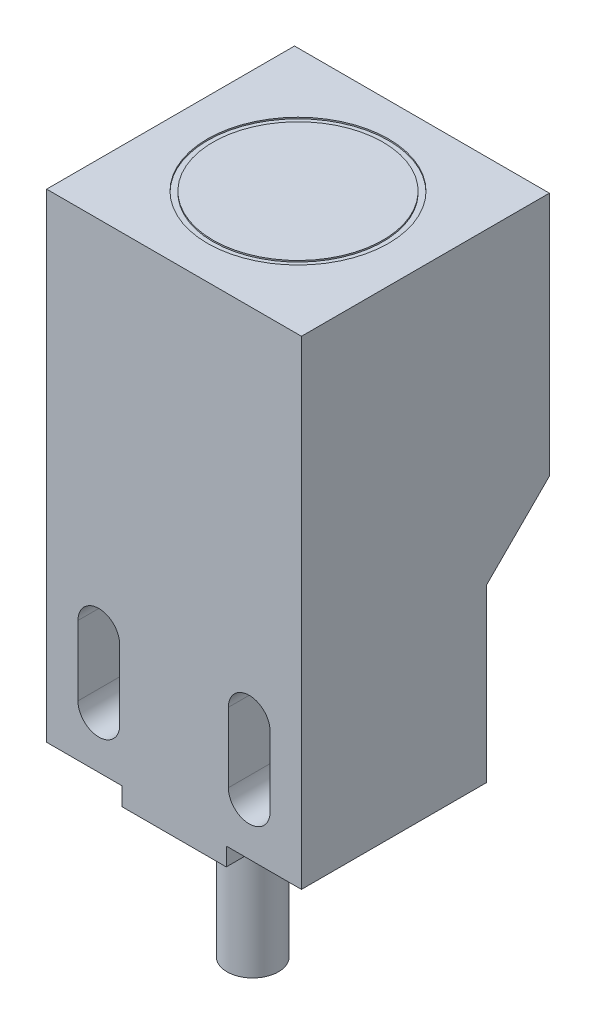
from build123d import *

# Parameters (mm, degrees)
ESQUISSE1_W                  = 18.3
ESQUISSE1_H                  = 17.8
BOSS_EXTRU_1_DEPTH           = 34.4
ENL_V_MAT_EXTRU_1_DEPTH      = 37.69185877
ENL_V_MAT_EXTRU_1_DEPTH_BACK = 37.69185877
ENL_V_MAT_EXTRU_2_DEPTH      = 37.69185877
ENL_V_MAT_EXTRU_2_DEPTH_BACK = 37.69185877
ESQUISSE4_R                  = 4.25
BOSS_EXTRU_2_DEPTH           = 2.2
ESQUISSE5_R                  = 2.45
BOSS_EXTRU_3_DEPTH           = 2.1
BOSS_EXTRU_4_DEPTH           = 1.3
ESQUISSE7_R                  = 1.85
BOSS_EXTRU_5_DEPTH           = 10.3
ESQUISSE8_R                  = 6.5
ESQUISSE8_R_2                = 6.1
ENL_V_MAT_EXTRU_3_DEPTH      = 0.1


with BuildPart() as part:
    # Esquisse1 → Boss.-Extru.1 (new body)
    with BuildSketch(Plane(origin=(0, 0, 0), x_dir=(1, 0, 0), z_dir=(0, 1, 0))):
        Rectangle(ESQUISSE1_W, ESQUISSE1_H)
    extrude(amount=-BOSS_EXTRU_1_DEPTH)

    # Esquisse2 → Enlèv. mat.-Extru.1 (cut, two sides: drawn at the far end of the back side and taken through both)
    with BuildSketch(Plane(origin=(0, 0, 0), x_dir=(0, 0, -1), z_dir=(1, 0, 0)).offset(-ENL_V_MAT_EXTRU_1_DEPTH_BACK)):
        Polygon((8.9, -17.6), (4.4, -22.1), (4.4, -34.4), (8.9, -34.4), align=None)
    extrude(amount=ENL_V_MAT_EXTRU_1_DEPTH + ENL_V_MAT_EXTRU_1_DEPTH_BACK, mode=Mode.SUBTRACT)

    # Esquisse3 → Enlèv. mat.-Extru.2 (cut, two sides: drawn at the far end of the back side and taken through both)
    with BuildSketch(Plane.XY.offset(-ENL_V_MAT_EXTRU_2_DEPTH_BACK)):
        with BuildLine():
            Line((3.9, -30.7), (3.9, -25.7))
            ThreePointArc((3.9, -25.7), (5.4, -24.2), (6.9, -25.7))
            Line((6.9, -25.7), (6.9, -30.7))
            ThreePointArc((6.9, -30.7), (5.4, -32.2), (3.9, -30.7))
        make_face()
        with BuildLine():
            Line((-3.9, -30.7), (-3.9, -25.7))
            ThreePointArc((-3.9, -25.7), (-5.4, -24.2), (-6.9, -25.7))
            Line((-6.9, -25.7), (-6.9, -30.7))
            ThreePointArc((-6.9, -30.7), (-5.4, -32.2), (-3.9, -30.7))
        make_face()
    extrude(amount=ENL_V_MAT_EXTRU_2_DEPTH + ENL_V_MAT_EXTRU_2_DEPTH_BACK, mode=Mode.SUBTRACT)

    # Esquisse4 → Boss.-Extru.2 (add)
    with BuildSketch(Plane(origin=(0, 0, -4.4), x_dir=(-1, 0, 0), z_dir=(0, 0, -1))):
        with Locations((0, -19.85)):
            Circle(ESQUISSE4_R)
    extrude(amount=BOSS_EXTRU_2_DEPTH)

    # Esquisse5 → Boss.-Extru.3 (add)
    with BuildSketch(Plane(origin=(0, 0, -6.6), x_dir=(-1, 0, 0), z_dir=(0, 0, -1))):
        with Locations((0, -19.85)):
            Circle(ESQUISSE5_R)
    extrude(amount=BOSS_EXTRU_3_DEPTH)

    # Esquisse6 → Boss.-Extru.4 (add)
    with BuildSketch(Plane.XZ.offset(34.4)):
        with BuildLine():
            Line((3.75, 8.9), (3.75, 3.25))
            ThreePointArc((3.75, 3.25), (0, -0.5), (-3.75, 3.25))
            Line((-3.75, 3.25), (-3.75, 8.9))
            Line((-3.75, 8.9), (3.75, 8.9))
        make_face()
    extrude(amount=BOSS_EXTRU_4_DEPTH)

    # Esquisse7 → Boss.-Extru.5 (add)
    with BuildSketch(Plane.XZ.offset(35.7)):
        with Locations(Location((0, 3.25, 0), (0, 0, 90))):
            Circle(ESQUISSE7_R)
    extrude(amount=BOSS_EXTRU_5_DEPTH)

    # Esquisse8 → Enlèv. mat.-Extru.3 (cut)
    with BuildSketch(Plane(origin=(0, 0, 0), x_dir=(1, 0, 0), z_dir=(0, 1, 0))):
        with Locations(Location((0, 0, 0), (0, 0, 270))):
            Circle(ESQUISSE8_R)
        with Locations(Location((0, 0, 0), (0, 0, 270))):
            Circle(ESQUISSE8_R_2, mode=Mode.SUBTRACT)
    extrude(amount=-ENL_V_MAT_EXTRU_3_DEPTH, mode=Mode.SUBTRACT)


solid = part.part
